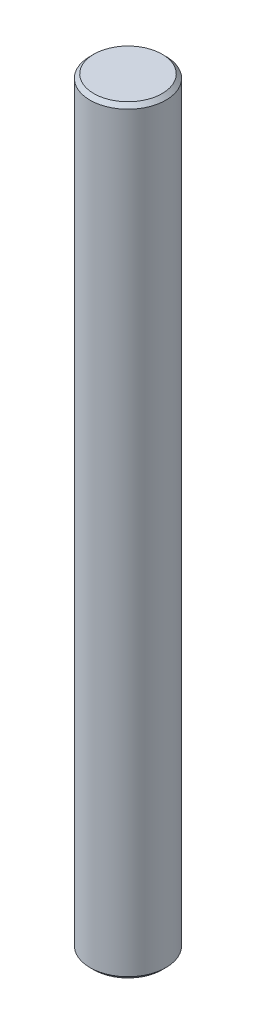
from build123d import *

# Parameters (mm, degrees)
SKETCH1_R           = 2.5
BOSS_EXTRUDE1_DEPTH = 25
CHAMFER1_SIZE       = 0.25


with BuildPart() as part:
    # Sketch1 → Boss-Extrude1 (new, symmetric)
    with BuildSketch(Plane(origin=(0, 0, 0), x_dir=(1, 0, 0), z_dir=(0, 1, 0))):
        with Locations(Location((0, 0, 0), (0, 0, 270))):
            Circle(SKETCH1_R)
    extrude(amount=BOSS_EXTRUDE1_DEPTH, both=True)

    # Chamfer1
    chamfer1_edges = [part.edges().sort_by_distance(p)[0] for p in [
        (0, -25, -2.5),
        (0, 25, -2.5),
    ]]
    chamfer(chamfer1_edges, length=CHAMFER1_SIZE)


solid = part.part
